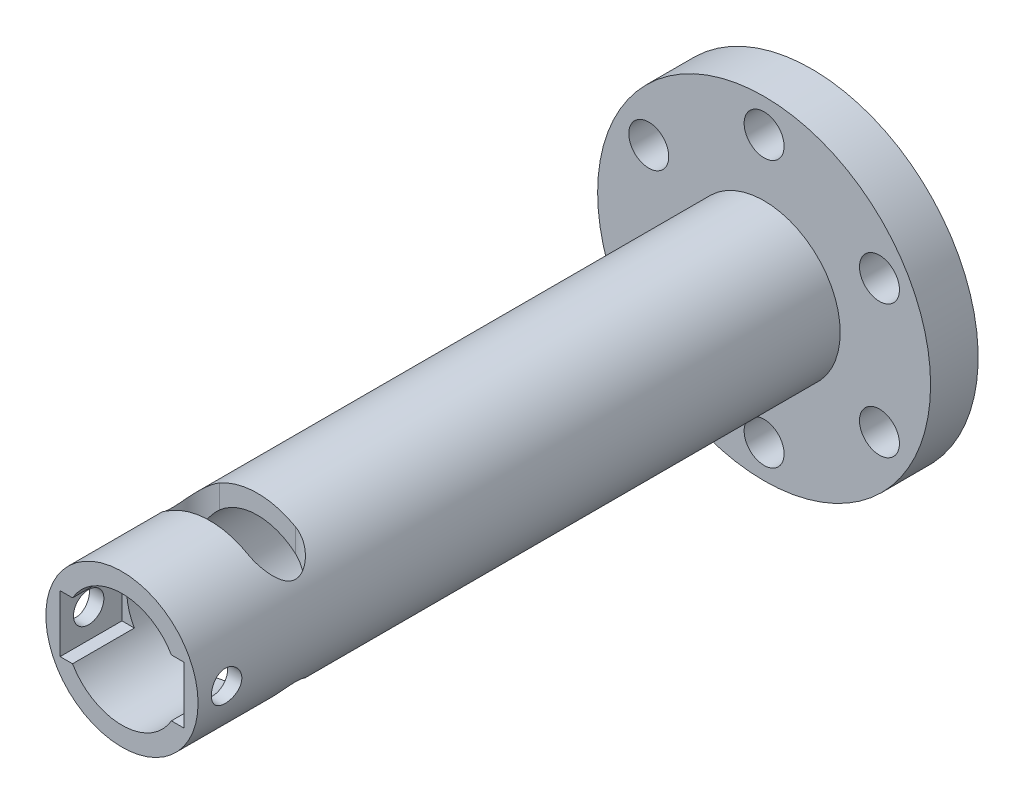
from build123d import *

# Parameters (mm, degrees)
SKETCH_1_R                = 17.499999999999996
SKETCH_1_R_2              = 2
SKETCH_1_R_3              = 2.000000000000001
SKETCH_1_R_4              = 1.9999999999999996
EXTRUDE_1_DEPTH           = 2
SKETCH_2_R                = 8
EXTRUDE_2_DEPTH           = 61.5
SKETCH_6_R                = 8
EXTRUDE_3_DEPTH           = 2
SKETCH_7_R                = 5
CUT_EXTRUDE_2_DEPTH       = 63.5
SKETCH_21_R               = 7
CUT_EXTRUDE_4_DEPTH       = 63.5
CUT_EXTRUDE_5_DEPTH       = 2
CUT_EXTRUDE_START         = -18
SKETCH_30_R               = 8
CUT_EXTRUDE_7_DEPTH       = 18
SKETCH_35_R               = 2.1
SKETCH_35_R_2             = 2.100000000000001
SKETCH_35_R_3             = 2.1000000000000005
SKETCH_35_R_4             = 2.099999999999999
CUT_EXTRUDE_9_DEPTH       = 10
EXTRUDE_START             = 3
SKETCH_37_R               = 17.5
SKETCH_37_R_2             = 2.1000000000000005
SKETCH_37_R_3             = 2.0999999999999996
SKETCH_37_R_4             = 2.099999999999999
EXTRUDE_5_DEPTH           = 3
EXTRUDE_7_DEPTH           = 10
EXTRUDE_7_DEPTH_BACK      = 46.00000000000002
SKETCH_44_R               = 8
SKETCH_44_R_2             = 6
CUT_EXTRUDE_21_DEPTH      = 55.5
SKETCH_47_R               = 7.999999999999998
EXTRUDE_8_DEPTH           = 5
SKETCH_48_R               = 7.999999999999998
EXTRUDE_9_DEPTH           = 7
CUT_EXTRUDE_22_DEPTH      = 21.000000000000004
CUT_EXTRUDE_22_DEPTH_BACK = 11.000000000000004
SKETCH_49_R               = 1.6000000000000052
SKETCH_52_R               = 6.798902153846566
CUT_EXTRUDE_25_DEPTH      = 10
EXTRUDE_START_2           = 5
SKETCH_53_R               = 6.798902153846566
SKETCH_53_R_2             = 6.000000000000001
EXTRUDE_11_DEPTH          = 5
CUT_EXTRUDE_26_DEPTH      = 21
CUT_EXTRUDE_26_DEPTH_BACK = 29
EXTRUDE_13_DEPTH          = 61.00000000000004


with BuildPart() as part:
    # 草图1 → 凸台-拉伸1 (new body)
    with BuildSketch(Plane.XY):
        Circle(SKETCH_1_R)
        with Locations((0, 14)):
            Circle(SKETCH_1_R_2, mode=Mode.SUBTRACT)
        with Locations((12.124355652982159, 6.999999999999974)):
            Circle(SKETCH_1_R_3, mode=Mode.SUBTRACT)
        with Locations((12.12435565298211, -7.000000000000057)):
            Circle(SKETCH_1_R_4, mode=Mode.SUBTRACT)
        with Locations((-9.776e-14, -14)):
            Circle(SKETCH_1_R_2, mode=Mode.SUBTRACT)
        with Locations((-12.12435565298221, -6.999999999999886)):
            Circle(SKETCH_1_R_4, mode=Mode.SUBTRACT)
        with Locations((-12.12435565298206, 7.000000000000141)):
            Circle(SKETCH_1_R_3, mode=Mode.SUBTRACT)
    extrude(amount=EXTRUDE_1_DEPTH)

    # 草图2 → 凸台-拉伸2 (add)
    with BuildSketch(Plane.XY.offset(2)):
        Circle(SKETCH_2_R)
    extrude(amount=EXTRUDE_2_DEPTH)

    # 草图6 → 凸台-拉伸3 (add)
    with BuildSketch(Plane.XY.offset(63.5)):
        Circle(SKETCH_6_R)
    extrude(amount=EXTRUDE_3_DEPTH)

    # 草图7 → 切除-拉伸2 (cut)
    with BuildSketch(Plane.XY.offset(65.5)):
        Circle(SKETCH_7_R)
    extrude(amount=-CUT_EXTRUDE_2_DEPTH, mode=Mode.SUBTRACT)

    # 草图21 → 切除-拉伸4 (cut)
    with BuildSketch(Plane.XY.offset(65.5)):
        Circle(SKETCH_21_R)
    extrude(amount=-CUT_EXTRUDE_4_DEPTH, mode=Mode.SUBTRACT)

    # 草图22 → 切除-拉伸5 (cut)
    with BuildSketch(Plane(origin=(0, 0, 0), x_dir=(-1, 0, 0), z_dir=(0, 0, -1))):
        with BuildLine():
            ThreePointArc((2.99966326467678, -5.999663264676775), (5.484805158577535, 3.7e-16), (2.9996632646767774, 5.999663264676775))
            ThreePointArc((2.9996632646767774, 5.999663264676775), (1.0003367353232246, 5.9996632646767765), (1.0003367353232226, 4.0003367353232235))
            ThreePointArc((1.0003367353232226, 4.0003367353232235), (2.6573304651534118, -2.6e-16), (1.000336735323225, -4.000336735323225))
            ThreePointArc((1.000336735323225, -4.000336735323225), (1.0003367353232278, -5.999663264676777), (2.99966326467678, -5.999663264676775))
        make_face()
        with BuildLine():
            ThreePointArc((-2.999663264675801, 5.999663264676881), (-5.48480515857711, 2.7491e-13), (-2.9996632646768204, -5.999663264676754))
            ThreePointArc((-2.9996632646768204, -5.999663264676754), (-1.0003367353232673, -5.99966326467677), (-1.0003367353232513, -4.000336735323216))
            ThreePointArc((-1.0003367353232513, -4.000336735323216), (-2.657330465152986, 1.3523e-13), (-1.00033673532243, 4.000336735323146))
            ThreePointArc((-1.00033673532243, 4.000336735323146), (-1.0003367353222479, 5.999663264676704), (-2.999663264675801, 5.999663264676881))
        make_face()
    extrude(amount=-CUT_EXTRUDE_5_DEPTH, mode=Mode.SUBTRACT)

    # 草图30 → 切除-拉伸7 (cut)
    with BuildSketch(Plane.XY.offset(65.5).offset(CUT_EXTRUDE_START)):
        Circle(SKETCH_30_R)
    extrude(amount=CUT_EXTRUDE_7_DEPTH, mode=Mode.SUBTRACT)

    # 草图35 → 切除-拉伸9 (cut)
    with BuildSketch(Plane(origin=(0, 0, 0), x_dir=(-1, 0, 0), z_dir=(0, 0, -1))):
        with Locations((0, 14)):
            Circle(SKETCH_35_R)
        with Locations((12.124355652982159, 6.999999999999974)):
            Circle(SKETCH_35_R_2)
        with Locations((12.12435565298211, -7.000000000000057)):
            Circle(SKETCH_35_R_2)
        with Locations((-9.776e-14, -14)):
            Circle(SKETCH_35_R)
        with Locations((-12.12435565298221, -6.999999999999886)):
            Circle(SKETCH_35_R_3)
        with Locations((-12.12435565298206, 7.000000000000141)):
            Circle(SKETCH_35_R_4)
    extrude(amount=-CUT_EXTRUDE_9_DEPTH, mode=Mode.SUBTRACT)

    # 草图37 → 凸台-拉伸5 (add)
    with BuildSketch(Plane(origin=(0, 0, 0), x_dir=(-1, 0, 0), z_dir=(0, 0, -1)).offset(EXTRUDE_START)):
        Circle(SKETCH_37_R)
        with Locations((12.124355652982159, 6.999999999999974)):
            Circle(SKETCH_37_R_2, mode=Mode.SUBTRACT)
        with Locations((12.12435565298211, -7.000000000000057)):
            Circle(SKETCH_37_R_2, mode=Mode.SUBTRACT)
        with Locations((-9.776e-14, -14)):
            Circle(SKETCH_37_R_3, mode=Mode.SUBTRACT)
        with Locations((-12.12435565298221, -6.999999999999886)):
            Circle(SKETCH_37_R_2, mode=Mode.SUBTRACT)
        with Locations((-12.12435565298206, 7.000000000000141)):
            Circle(SKETCH_37_R_4, mode=Mode.SUBTRACT)
        with Locations((0, 14)):
            Circle(SKETCH_37_R_3, mode=Mode.SUBTRACT)
        with BuildLine():
            ThreePointArc((-2.999663264676821, -5.999663264676754), (-1.000336735323267, -5.99966326467677), (-1.0003367353232513, -4.000336735323216))
            ThreePointArc((-1.0003367353232513, -4.000336735323216), (-2.6573304651529885, 1.3523e-13), (-1.0003367353224324, 4.000336735323147))
            ThreePointArc((-1.0003367353224324, 4.000336735323147), (-1.0003367353222492, 5.999663264676702), (-2.9996632646758017, 5.999663264676881))
            ThreePointArc((-2.9996632646758017, 5.999663264676881), (-5.484805158577112, 2.7491e-13), (-2.999663264676821, -5.999663264676754))
        make_face(mode=Mode.SUBTRACT)
        with BuildLine():
            ThreePointArc((1.000336735323223, -4.000336735323228), (1.0003367353232275, -5.9996632646767765), (2.9996632646767774, -5.999663264676779))
            ThreePointArc((2.9996632646767774, -5.999663264676779), (5.484805158577537, -2.46e-15), (2.999663264676779, 5.999663264676775))
            ThreePointArc((2.999663264676779, 5.999663264676775), (1.000336735323224, 5.999663264676778), (1.0003367353232224, 4.0003367353232235))
            ThreePointArc((1.0003367353232224, 4.0003367353232235), (2.6573304651534126, -1.52e-15), (1.000336735323223, -4.000336735323228))
        make_face(mode=Mode.SUBTRACT)
    extrude(amount=-EXTRUDE_5_DEPTH)

    # 草图44 → 凸台-拉伸7 (add, two sides: drawn at the far end of the back side and taken through both)
    with BuildSketch(Plane.XY.offset(47.5).offset(-EXTRUDE_7_DEPTH_BACK)):
        Circle(SKETCH_44_R)
        Circle(SKETCH_44_R_2, mode=Mode.SUBTRACT)
    extrude(amount=EXTRUDE_7_DEPTH + EXTRUDE_7_DEPTH_BACK)

    # 草图46 → 切除-拉伸21 (cut)
    with BuildSketch(Plane.XY.offset(57.5)):
        with BuildLine():
            Line((-6.5, -3), (-5.196152422706578, -3))
            ThreePointArc((-5.196152422706599, -3.000000000000059), (-6.000000000000001, 7.3e-16), (-5.1961524227066, 3.0000000000000577))
            Line((-5.196152422706579, 2.999999999999998), (-6.500000000000001, 2.9999999999999973))
            Line((-6.500000000000001, 2.9999999999999973), (-6.5, -3))
        make_face()
        with BuildLine():
            Line((-5.196152422706578, -3), (0, -3))
            Line((0, -3), (-1.1e-15, 3))
            Line((-1.1e-15, 3), (-5.196152422706579, 2.999999999999998))
            ThreePointArc((-5.1961524227066, 3.0000000000000577), (-6.000000000000001, 7.3e-16), (-5.196152422706599, -3.000000000000059))
        make_face()
        with BuildLine():
            Line((-1.1e-15, 3), (0, -3))
            Line((0, -3), (5.196152422706767, -3))
            ThreePointArc((5.196152422706716, -2.9999999999998557), (5.795554957734432, -1.552914270615042), (6.000000000000001, -1.47e-15))
            ThreePointArc((6.000000000000001, 0), (5.795554957734432, 1.5529142706150447), (5.1961524227067155, 2.999999999999857))
            Line((5.196152422706765, 3), (-1.1e-15, 3))
        make_face()
        with BuildLine():
            ThreePointArc((6.000000000000001, -1.47e-15), (5.795554957734432, -1.552914270615042), (5.196152422706716, -2.9999999999998557))
            Line((5.196152422706767, -3), (6.5, -3))
            Line((6.5, -3), (6.5, 3))
            Line((6.5, 3), (5.196152422706765, 3))
            ThreePointArc((5.1961524227067155, 2.999999999999857), (5.795554957734432, 1.5529142706150447), (6.000000000000001, 0))
        make_face()
    extrude(amount=-CUT_EXTRUDE_21_DEPTH, mode=Mode.SUBTRACT)

    # 草图47 → 凸台-拉伸8 (add)
    with BuildSketch(Plane.XY.offset(57.5)):
        Circle(SKETCH_47_R)
        with BuildLine():
            Line((5.196152422706634, -3), (6.5, -3))
            Line((6.5, -3), (6.5, 3))
            Line((6.5, 3), (5.196152422706633, 3.000000000000002))
            ThreePointArc((5.196152422706633, 3.000000000000002), (-2.3e-15, 6.000000000000002), (-5.196152422706635, 2.999999999999998))
            Line((-5.196152422706635, 2.999999999999998), (-6.500000000000001, 2.9999999999999973))
            Line((-6.500000000000001, 2.9999999999999973), (-6.5, -3))
            Line((-6.5, -3), (-5.196152422706634, -3))
            ThreePointArc((-5.196152422706634, -3), (3.7e-16, -6.000000000000002), (5.196152422706634, -3))
        make_face(mode=Mode.SUBTRACT)
    extrude(amount=EXTRUDE_8_DEPTH)

    # 草图48 → 凸台-拉伸9 (add)
    with BuildSketch(Plane.XY.offset(62.5)):
        Circle(SKETCH_48_R)
        with BuildLine():
            Line((-5.196152422706634, -2.9999999999999987), (-6.5, -3))
            Line((-6.5, -3), (-6.500000000000001, 2.9999999999999973))
            Line((-6.500000000000001, 2.9999999999999973), (-5.196152422706635, 2.999999999999998))
            ThreePointArc((-5.196152422706635, 2.999999999999998), (-2.3e-15, 6.000000000000002), (5.196152422706633, 3.000000000000002))
            Line((5.196152422706633, 3.000000000000002), (6.5, 3))
            Line((6.5, 3), (6.5, -3))
            Line((6.5, -3), (5.196152422706634, -3))
            ThreePointArc((5.196152422706634, -3), (-9.6e-16, -6.000000000000001), (-5.196152422706634, -2.9999999999999987))
        make_face(mode=Mode.SUBTRACT)
    extrude(amount=EXTRUDE_9_DEPTH)

    # 草图49 → 切除-拉伸22 (cut, two sides: drawn at the far end of the back side and taken through both)
    with BuildSketch(Plane(origin=(0, 0, 0), x_dir=(0, 0, -1), z_dir=(1, 0, 0)).offset(-CUT_EXTRUDE_22_DEPTH_BACK)):
        with Locations(Location((-66.5, 0, 0), (0, 0, 180))):
            Circle(SKETCH_49_R)
    extrude(amount=CUT_EXTRUDE_22_DEPTH + CUT_EXTRUDE_22_DEPTH_BACK, mode=Mode.SUBTRACT)

    # 草图52 → 切除-拉伸25 (cut)
    with BuildSketch(Plane.XY.offset(2)):
        with Locations(Location((0, 0, 0), (0, 0, 17.052451517))):
            Circle(SKETCH_52_R)
    extrude(amount=-CUT_EXTRUDE_25_DEPTH, mode=Mode.SUBTRACT)

    # 草图53 → 凸台-拉伸11 (add)
    with BuildSketch(Plane(origin=(0, 0, 2), x_dir=(-1, 0, 0), z_dir=(0, 0, -1)).offset(EXTRUDE_START_2)):
        Circle(SKETCH_53_R)
        with Locations(Location((0, 0, 0), (0, 0, 150))):
            Circle(SKETCH_53_R_2, mode=Mode.SUBTRACT)
    extrude(amount=-EXTRUDE_11_DEPTH)

    # 草图56 → 切除-拉伸26 (cut, two sides: drawn at the far end of the back side and taken through both)
    with BuildSketch(Plane(origin=(0, 0, 0), x_dir=(1, 0, 0), z_dir=(0, 1, 0)).offset(-CUT_EXTRUDE_26_DEPTH_BACK)):
        with BuildLine():
            Line((4.000000000000007, -60.249924116242), (-3.9999999999999933, -60.249924116242))
            ThreePointArc((-3.9999999999999933, -60.249924116242), (-6.5, -57.749924116242), (-3.9999999999999942, -55.24992411624199))
            Line((-3.9999999999999942, -55.24992411624199), (4.000000000000008, -55.24992411624199))
            ThreePointArc((4.000000000000008, -55.24992411624199), (6.500000000000007, -57.749924116242), (4.000000000000007, -60.249924116242))
        make_face()
    extrude(amount=CUT_EXTRUDE_26_DEPTH + CUT_EXTRUDE_26_DEPTH_BACK, mode=Mode.SUBTRACT)

    # 草图57 → 凸台-拉伸13 (add)
    with BuildSketch(Plane.XY.offset(2)):
        with BuildLine():
            ThreePointArc((-5.196152422706635, -2.999999999999999), (-6.000000000000002, 7.3e-16), (-5.196152422706635, 2.9999999999999982))
            Line((-5.196152422706635, 2.999999999999998), (-6.500000000000001, 2.9999999999999973))
            Line((-6.500000000000001, 2.9999999999999973), (-6.5, -3))
            Line((-6.5, -3), (-5.196152422706634, -2.9999999999999987))
        make_face()
        with BuildLine():
            Line((6.5, 3), (5.196152422706633, 3.000000000000002))
            ThreePointArc((5.196152422706633, 3.000000000000002), (6.000000000000002, 1.33e-15), (5.196152422706634, -3.000000000000001))
            Line((5.196152422706634, -3), (6.5, -3))
            Line((6.5, -3), (6.5, 3))
        make_face()
    extrude(amount=EXTRUDE_13_DEPTH)


solid = part.part
